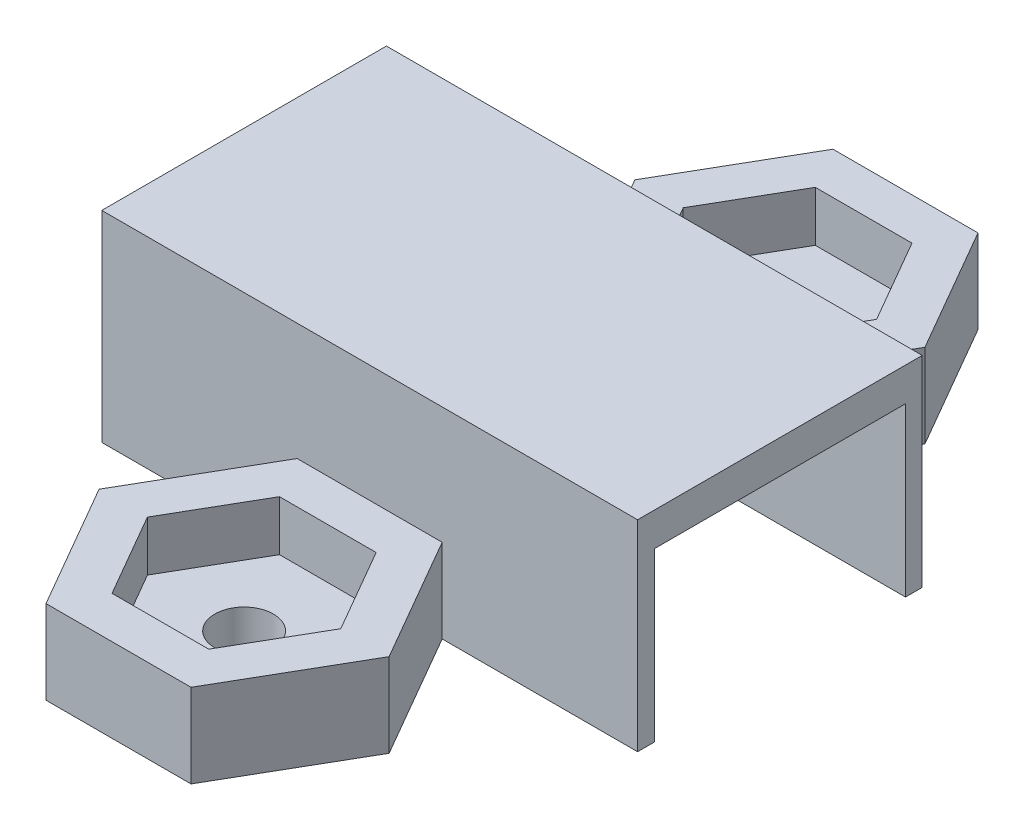
from build123d import *

# Parameters (mm, degrees)
SKETCH1_W           = 32
SKETCH1_H           = 17
BOSS_EXTRUDE1_DEPTH = 12
SKETCH2_W           = 15
SKETCH2_H           = 10
CUT_EXTRUDE1_DEPTH  = 58
BOSS_EXTRUDE2_DEPTH = 5
CUT_EXTRUDE2_DEPTH  = 3
SKETCH5_R           = 1.75
CUT_EXTRUDE3_DEPTH  = 4


with BuildPart() as part:
    # Sketch1 → Boss-Extrude1 (new body)
    with BuildSketch(Plane(origin=(0, 0, 0), x_dir=(1, 0, 0), z_dir=(0, 1, 0))):
        Rectangle(SKETCH1_W, SKETCH1_H)
    extrude(amount=BOSS_EXTRUDE1_DEPTH)

    # Sketch2 → Cut-Extrude1 (cut)
    with BuildSketch(Plane.ZY.offset(16)):
        with Locations((0, 5)):
            Rectangle(SKETCH2_W, SKETCH2_H)
    extrude(amount=-CUT_EXTRUDE1_DEPTH, mode=Mode.SUBTRACT)

    # Sketch3 → Boss-Extrude2 (add)
    with BuildSketch(Plane.XZ):
        Polygon((4.330127019, -8.5), (-4.330127019, -8.5), (-8.660254038, -16), (-4.330127019, -23.5), (4.330127019, -23.5), (8.660254038, -16), align=None)
        Polygon((8.660254038, 16), (4.330127019, 8.5), (-4.330127019, 8.5), (-8.660254038, 16), (-4.330127019, 23.5), (4.330127019, 23.5), align=None)
    extrude(amount=-BOSS_EXTRUDE2_DEPTH)

    # Sketch4 → Cut-Extrude2 (cut)
    with BuildSketch(Plane(origin=(0, 5, 0), x_dir=(1, 0, 0), z_dir=(0, 1, 0))):
        Polygon((2.886751346, 11), (5.773502692, 16), (2.886751346, 21), (-2.886751346, 21), (-5.773502692, 16), (-2.886751346, 11), align=None)
        Polygon((2.886751346, -21), (5.773502692, -16), (2.886751346, -11), (-2.886751346, -11), (-5.773502692, -16), (-2.886751346, -21), align=None)
    extrude(amount=-CUT_EXTRUDE2_DEPTH, mode=Mode.SUBTRACT)

    # Sketch5 → Cut-Extrude3 (cut)
    with BuildSketch(Plane(origin=(0, 2, 0), x_dir=(1, 0, 0), z_dir=(0, 1, 0))):
        with Locations(Location((0, 16, 0), (0, 0, 270))):
            Circle(SKETCH5_R)
        with Locations(Location((0, -16, 0), (0, 0, 270))):
            Circle(SKETCH5_R)
    extrude(amount=-CUT_EXTRUDE3_DEPTH, mode=Mode.SUBTRACT)


solid = part.part
